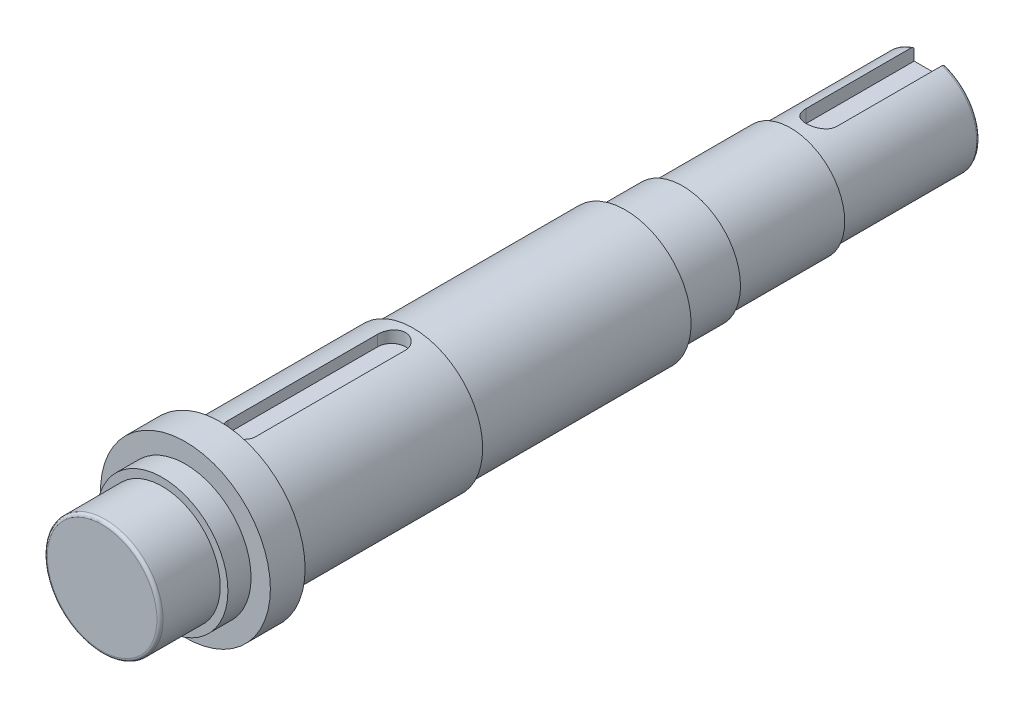
from build123d import *

# Parameters (mm, degrees)
FILLET1_R          = 2
CUT_EXTRUDE1_START = 37
CUT_EXTRUDE1_DEPTH = 10
CUT_EXTRUDE2_START = 22.5
CUT_EXTRUDE2_DEPTH = 10


with BuildPart() as part:
    # Sketch1 → Revolve1 (revolve)
    with BuildSketch(Plane(origin=(0, 0, 0), x_dir=(0, 0, -1), z_dir=(1, 0, 0)), mode=Mode.PRIVATE) as revolve1_sk:
        Polygon((0, 0), (536, 0), (536, 32.5), (446, 32.5), (446, 35), (376, 35), (376, 37.5), (339, 37.5), (339, 42.5), (201.5, 42.5), (201.5, 45), (76.5, 45), (76.5, 55), (54, 55), (54, 42.5), (39, 42.5), (39, 37.5), (0, 37.5), align=None)
    revolve(revolve1_sk.sketch.rotate(Axis((0, 0, 0), (0, 0, -1)), 90), axis=Axis((0, 0, 0), (0, 0, -1)))

    # Fillet1
    fillet1_edges = [part.edges().sort_by_distance(p)[0] for p in [
        (-37.5, 0, 0),
        (-32.5, 0, -536),
    ]]
    fillet(fillet1_edges, radius=FILLET1_R)

    # Sketch2 → Cut-Extrude1 (cut)
    with BuildSketch(Plane(origin=(0, 0, 0), x_dir=(1, 0, 0), z_dir=(0, 1, 0)).offset(CUT_EXTRUDE1_START)):
        with BuildLine():
            Line((9, 187.5), (9, 90.5))
            ThreePointArc((9, 90.5), (0, 81.5), (-9, 90.5))
            Line((-9, 90.5), (-9, 187.5))
            ThreePointArc((-9, 187.5), (0, 196.5), (9, 187.5))
        make_face()
    extrude(amount=CUT_EXTRUDE1_DEPTH, mode=Mode.SUBTRACT)

    # Sketch3 → Cut-Extrude2 (cut)
    with BuildSketch(Plane(origin=(0, 0, 0), x_dir=(1, 0, 0), z_dir=(0, 1, 0)).offset(CUT_EXTRUDE2_START)):
        with BuildLine():
            Line((10, 536), (10, 466))
            ThreePointArc((10, 466), (0, 456), (-10, 466))
            Line((-10, 466), (-10, 536))
            ThreePointArc((-10, 536), (0, 546), (10, 536))
        make_face()
    extrude(amount=CUT_EXTRUDE2_DEPTH, mode=Mode.SUBTRACT)


solid = part.part
